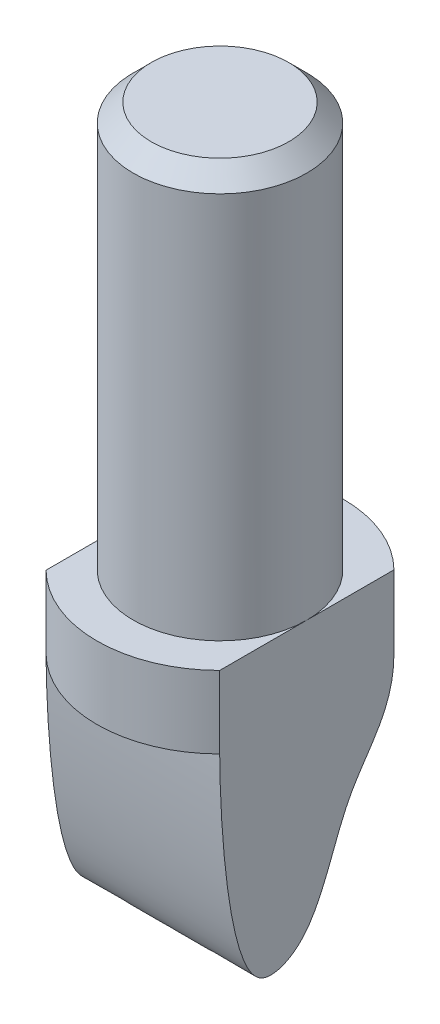
from build123d import *

# Parameters (mm, degrees)
SKETCH1_R                       = 1.2
BOSS_EXTRUDE3_DEPTH             = 6.6
CHAMFER1_SIZE                   = 0.25
BOSS_EXTRUDE4_DEPTH             = 1
BOSS_EXTRUDE5_REACH             = 8.92
BOSS_EXTRUDE5_DIRECTION_2_REACH = 8.92


with BuildPart() as part:
    # Sketch1 → Boss-Extrude3 (new body)
    with BuildSketch(Plane(origin=(0, 0, 0), x_dir=(1, 0, 0), z_dir=(0, 1, 0))):
        with Locations(Location((0, 0, 0), (0, 0, 270))):
            Circle(SKETCH1_R)
    extrude(amount=BOSS_EXTRUDE3_DEPTH)

    # Chamfer1
    chamfer1_edges = [part.edges().sort_by_distance(p)[0] for p in [
        (0, 6.6, -1.2),
    ]]
    chamfer(chamfer1_edges, length=CHAMFER1_SIZE)

    # Sketch3 → Boss-Extrude4 (add)
    with BuildSketch(Plane(origin=(0, 0, 0), x_dir=(1, 0, 0), z_dir=(0, 1, 0))):
        with BuildLine():
            Line((-1.2, 0), (-1.2, -1.204159458))
            ThreePointArc((-1.2, -1.204159458), (0, -1.7), (1.2, -1.204159458))
            Line((1.2, -1.204159458), (1.2, 0))
            ThreePointArc((1.2, 0), (0, -1.2), (-1.2, 0))
        make_face()
        with BuildLine():
            Line((-1.2, 1.204159458), (-1.2, 0))
            ThreePointArc((-1.2, 0), (0, 1.2), (1.2, 0))
            Line((1.2, 0), (1.2, 1.204159458))
            ThreePointArc((1.2, 1.204159458), (0, 1.7), (-1.2, 1.204159458))
        make_face()
    extrude(amount=BOSS_EXTRUDE4_DEPTH)

    # Boss-Extrude5: up to this face of the body (flat: up to its plane)
    boss_extrude5_end = Plane(part.part.faces().sort_by_distance((1.2, 0.5, 0))[0])
    # Sketch2 → Boss-Extrude5 (add, up to the picked face)
    with BuildSketch(Plane(origin=(0, 0, 0), x_dir=(0, 0, -1), z_dir=(1, 0, 0)), mode=Mode.PRIVATE) as boss_extrude5_sk1:
        with BuildLine():
            Line((-1.204159458, 0), (1.204159458, 0))
            add(Edge.make_bspline(
                [(1.204159458, 0), (1.204159458, -0.666666667), (0.402493307, -1.289775359), (0.160723245, -2.93084984), (-1.104899297, -3.09327163), (-1.204159458, -0.6), (-1.204159458, 0)],
                knots=[0, 0, 0, 0, 0.278964608, 0.615716948, 0.687820487, 1, 1, 1, 1], degree=3))
        make_face()
    boss_extrude5_tool1 = split(extrude(boss_extrude5_sk1.sketch, amount=BOSS_EXTRUDE5_REACH, mode=Mode.PRIVATE), bisect_by=boss_extrude5_end, keep=Keep.BOTH, mode=Mode.PRIVATE)
    add(boss_extrude5_tool1.solids().sort_by(Axis((0, -1.202365, 0.190001), (1, 0, 0)))[0])

    # Boss-Extrude5 direction 2: up to this face of the body (flat: up to its plane)
    boss_extrude5_direction_2_end = Plane(part.part.faces().sort_by_distance((-1.2, 0.5, 0))[0])
    # Sketch2 → Boss-Extrude5 direction 2 (add, up to the picked face)
    with BuildSketch(Plane(origin=(0, 0, 0), x_dir=(0, 0, -1), z_dir=(1, 0, 0)), mode=Mode.PRIVATE) as boss_extrude5_direction_2_sk1:
        with BuildLine():
            Line((-1.204159458, 0), (1.204159458, 0))
            add(Edge.make_bspline(
                [(1.204159458, 0), (1.204159458, -0.666666667), (0.402493307, -1.289775359), (0.160723245, -2.93084984), (-1.104899297, -3.09327163), (-1.204159458, -0.6), (-1.204159458, 0)],
                knots=[0, 0, 0, 0, 0.278964608, 0.615716948, 0.687820487, 1, 1, 1, 1], degree=3))
        make_face()
    boss_extrude5_direction_2_tool1 = split(extrude(boss_extrude5_direction_2_sk1.sketch, amount=-BOSS_EXTRUDE5_DIRECTION_2_REACH, mode=Mode.PRIVATE), bisect_by=boss_extrude5_direction_2_end, keep=Keep.BOTH, mode=Mode.PRIVATE)
    add(boss_extrude5_direction_2_tool1.solids().sort_by(Axis((0, -1.202365, 0.190001), (-1, 0, 0)))[0])


solid = part.part
